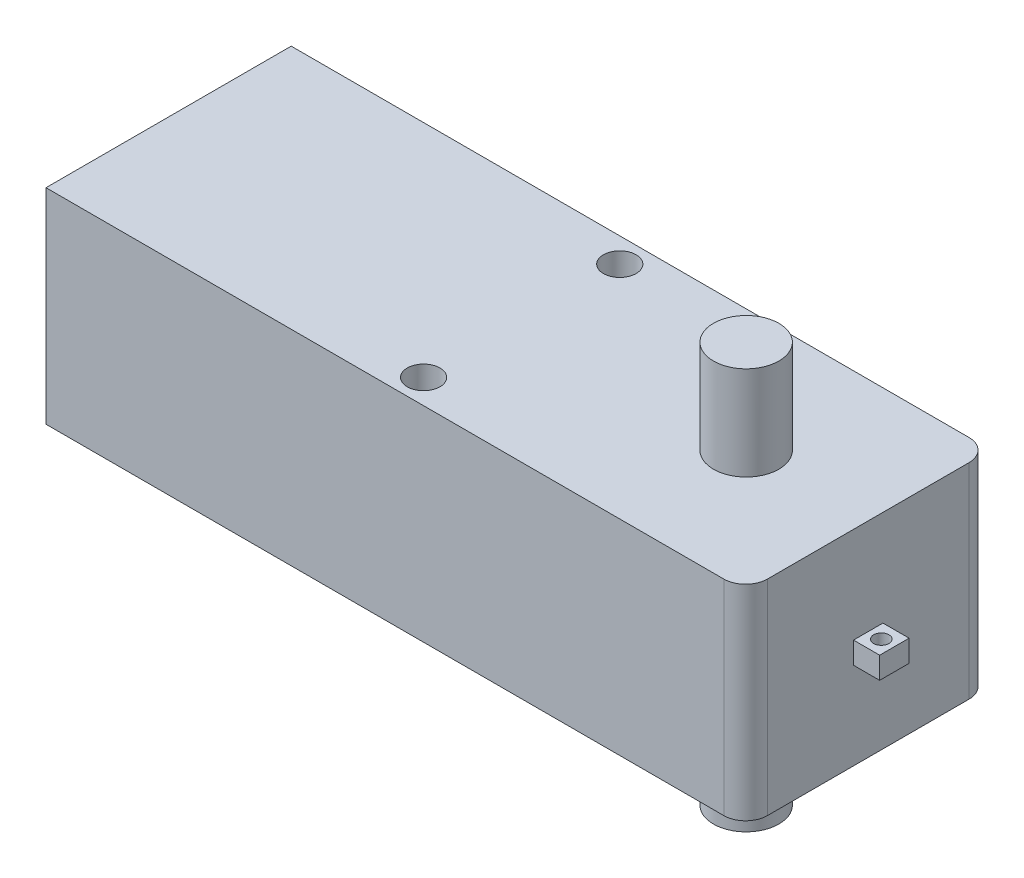
from build123d import *

# Parameters (mm, degrees)
SKETCH1_W           = 64.2
SKETCH1_H           = 22.5
SKETCH1_R           = 1.5
BOSS_EXTRUDE1_DEPTH = 18.8
SKETCH2_R           = 3
BOSS_EXTRUDE2_DEPTH = 18.4
SKETCH3_W           = 2.4
SKETCH3_H           = 2.701398926
SKETCH3_R           = 0.7
BOSS_EXTRUDE3_DEPTH = 1
FILLET1_R           = 2


with BuildPart() as part:
    # Sketch1 → Boss-Extrude1 (new body)
    with BuildSketch(Plane(origin=(0, 0, 0), x_dir=(1, 0, 0), z_dir=(0, 1, 0))):
        with Locations((32.1, 11.25)):
            Rectangle(SKETCH1_W, SKETCH1_H)
        with Locations(Location((32.4, 2.25, 0), (0, 0, 270))):
            Circle(SKETCH1_R, mode=Mode.SUBTRACT)
        with Locations(Location((32.4, 20.25, 0), (0, 0, 90))):
            Circle(SKETCH1_R, mode=Mode.SUBTRACT)
    extrude(amount=BOSS_EXTRUDE1_DEPTH)

    # Sketch2 → Boss-Extrude2 (add, symmetric)
    with BuildSketch(Plane(origin=(0, 9, 0), x_dir=(1, 0, 0), z_dir=(0, 1, 0))):
        with Locations(Location((53, 11.25, 0), (0, 0, 90))):
            Circle(SKETCH2_R)
    extrude(amount=BOSS_EXTRUDE2_DEPTH, both=True)

    # Sketch3 → Boss-Extrude3 (add, symmetric)
    with BuildSketch(Plane(origin=(0, 9, 0), x_dir=(1, 0, 0), z_dir=(0, 1, 0))):
        with Locations((65.4, 11.25)):
            Rectangle(SKETCH3_W, SKETCH3_H)
        with Locations(Location((65.4, 11.25, 0), (0, 0, 270))):
            Circle(SKETCH3_R, mode=Mode.SUBTRACT)
    extrude(amount=BOSS_EXTRUDE3_DEPTH, both=True)

    # Fillet1
    fillet1_edges = [part.edges().sort_by_distance(p)[0] for p in [
        (64.2, 9.4, -22.5),
        (64.2, 9.4, 0),
    ]]
    fillet(fillet1_edges, radius=FILLET1_R)


solid = part.part
